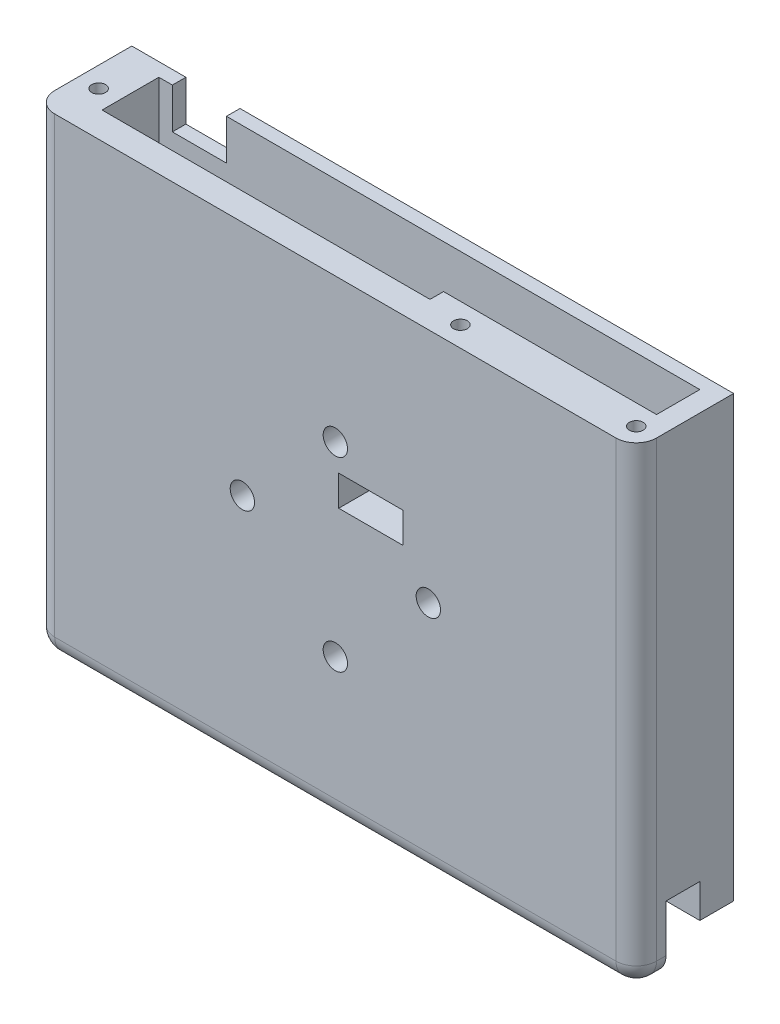
from build123d import *

# Parameters (mm, degrees)
BOSS_EXTRUDE1_DEPTH            = 6.4
SKETCH2_W                      = 89
SKETCH2_H                      = 70
BOSS_EXTRUDE2_DEPTH            = 2
SKETCH3_W                      = 8
SKETCH3_H                      = 6
CUT_EXTRUDE1_DEPTH             = 2
SKETCH5_W                      = 89
SKETCH5_H                      = 70
BOSS_EXTRUDE3_DEPTH            = 6
CBORE_FOR_M3_SHCS1_D           = 3.6
CBORE_FOR_M3_SHCS1_CBORE_D     = 7
CBORE_FOR_M3_SHCS1_CBORE_DEPTH = 11.5
SKETCH8_W                      = 9.5
SKETCH8_H                      = 4.5
CUT_EXTRUDE3_DEPTH             = 6
SKETCH10_W                     = 33.5
SKETCH10_H                     = 5
CUT_EXTRUDE4_DEPTH             = 2
M2_5X0_45_TAPPED_HOLE1_D       = 2.05
M2_5X0_45_TAPPED_HOLE1_DEPTH   = 7.25
M2_5X0_45_TAPPED_HOLE1_TIP     = 0.615882135
CUT_EXTRUDE5_DEPTH             = 97.43526326
FILLET1_R                      = 3


with BuildPart() as part:
    # Sketch1 → Boss-Extrude1 (new body)
    with BuildSketch(Plane.XY):
        Polygon((-38.5, -15), (-38.5, 35), (-44.5, 35), (-44.5, -35), (44.5, -35), (44.5, 35), (41.5, 35), (41.5, -15), align=None)
    extrude(amount=BOSS_EXTRUDE1_DEPTH)

    # Sketch2 → Boss-Extrude2 (add)
    with BuildSketch(Plane(origin=(0, 0, 0), x_dir=(-1, 0, 0), z_dir=(0, 0, -1))):
        Rectangle(SKETCH2_W, SKETCH2_H)
    extrude(amount=BOSS_EXTRUDE2_DEPTH)

    # Sketch3 → Cut-Extrude1 (cut)
    with BuildSketch(Plane.XY):
        with Locations((-32.5, 32)):
            Rectangle(SKETCH3_W, SKETCH3_H)
    extrude(amount=-CUT_EXTRUDE1_DEPTH, mode=Mode.SUBTRACT)

    # Sketch5 → Boss-Extrude3 (add)
    with BuildSketch(Plane.XY.offset(6.4)):
        Rectangle(SKETCH5_W, SKETCH5_H)
    extrude(amount=BOSS_EXTRUDE3_DEPTH)

    # CBORE for M3 SHCS1 (through all)
    with Locations(Plane(origin=(0, 0, -2), x_dir=(-1, 0, 0), z_dir=(0, 0, -1))):
        with Locations((0, -13.75), (0, 13.75), (-13.75, 0), (13.75, 0)):
            CounterBoreHole(CBORE_FOR_M3_SHCS1_D / 2, CBORE_FOR_M3_SHCS1_CBORE_D / 2, CBORE_FOR_M3_SHCS1_CBORE_DEPTH)

    # Sketch8 → Cut-Extrude3 (cut)
    with BuildSketch(Plane.XY.offset(12.4)):
        with Locations((5.25, 7.75)):
            Rectangle(SKETCH8_W, SKETCH8_H)
    extrude(amount=-CUT_EXTRUDE3_DEPTH, mode=Mode.SUBTRACT)

    # Sketch10 → Cut-Extrude4 (cut)
    with BuildSketch(Plane(origin=(0, 0, 6.4), x_dir=(-1, 0, 0), z_dir=(0, 0, -1))):
        Polygon((-10, 35), (-10, 10), (5, 10), (5, 30), (5, 35), align=None)
        with Locations((21.75, 32.5)):
            Rectangle(SKETCH10_W, SKETCH10_H)
    extrude(amount=-CUT_EXTRUDE4_DEPTH, mode=Mode.SUBTRACT)

    # M2.5x0.45 Tapped Hole1
    with Locations(Plane(origin=(0, 35, 0), x_dir=(1, 0, 0), z_dir=(0, 1, 0))):
        with Locations((-41.5, -5.9), (41.5, -9.4), (15.5, -9.4)):
            Hole(M2_5X0_45_TAPPED_HOLE1_D / 2, depth=M2_5X0_45_TAPPED_HOLE1_DEPTH)
            with Locations((0, 0, -(M2_5X0_45_TAPPED_HOLE1_DEPTH + M2_5X0_45_TAPPED_HOLE1_TIP / 2))):  # 118° drill point
                Cone(0, M2_5X0_45_TAPPED_HOLE1_D / 2, M2_5X0_45_TAPPED_HOLE1_TIP, mode=Mode.SUBTRACT)

    # Sketch13 → Cut-Extrude5 (cut, through all)
    with BuildSketch(Plane.ZY.offset(44.5)):
        Polygon((-2, -35), (8, -35), (8, -25), (3, -25), (3, -30), (-2, -30), align=None)
    extrude(amount=-CUT_EXTRUDE5_DEPTH, mode=Mode.SUBTRACT)

    # Fillet1
    fillet1_edges = [part.edges().sort_by_distance(p)[0] for p in [
        (44.5, -35, 10.2),
        (-44.5, -35, 10.2),
        (-44.5, 0, 12.4),
        (0, -35, 12.4),
        (44.5, 0, 12.4),
    ]]
    fillet(fillet1_edges, radius=FILLET1_R)


solid = part.part
